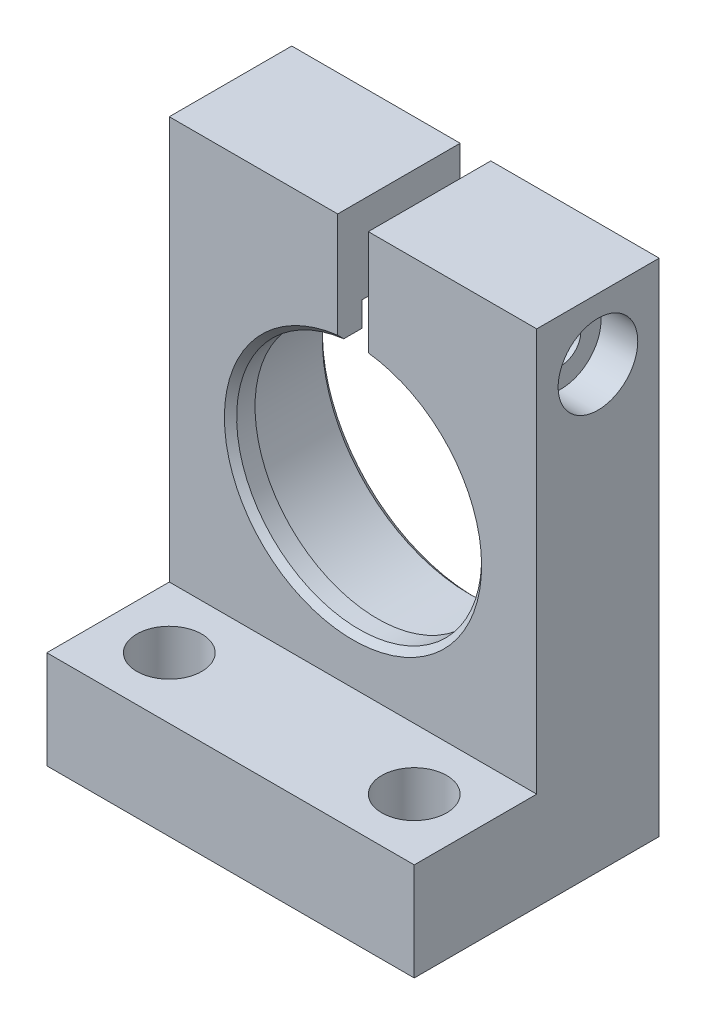
from build123d import *

# Parameters (mm, degrees)
SKETCH1_W                      = 30
SKETCH1_H                      = 40.9
SKETCH1_R                      = 12
BOSS_EXTRUDE1_DEPTH            = 10
BOSS_EXTRUDE2_START            = 2
SKETCH2_R                      = 12
SKETCH2_R_2                    = 10
BOSS_EXTRUDE2_DEPTH            = 2
SKETCH3_W                      = 2.5
SKETCH3_H                      = 9.078432584
CUT_EXTRUDE1_DEPTH             = 29.365648239
CBORE_FOR_M3_SHCS1_D           = 3.2
CBORE_FOR_M3_SHCS1_DEPTH       = 13.75
CBORE_FOR_M3_SHCS1_CBORE_D     = 6.5
CBORE_FOR_M3_SHCS1_CBORE_DEPTH = 3
TAP_DRILL_FOR_M3X0_5_TAP1_D    = 2.5
CHAMFER1_SIZE                  = 0.5
SKETCH8_W                      = 30
SKETCH8_H                      = 10
BOSS_EXTRUDE3_DEPTH            = 8
M5_CLEARANCE_HOLE1_D           = 5.3


with BuildPart() as part:
    # Sketch1 → Boss-Extrude1 (new body)
    with BuildSketch(Plane.XY):
        with Locations((0, -1.45)):
            Rectangle(SKETCH1_W, SKETCH1_H)
        Circle(SKETCH1_R, mode=Mode.SUBTRACT)
    extrude(amount=BOSS_EXTRUDE1_DEPTH)

    # Sketch2 → Boss-Extrude2 (add)
    with BuildSketch(Plane(origin=(0, 0, 10), x_dir=(-1, 0, 0), z_dir=(0, 0, -1)).offset(BOSS_EXTRUDE2_START)):
        Circle(SKETCH2_R)
        Circle(SKETCH2_R_2, mode=Mode.SUBTRACT)
    extrude(amount=-BOSS_EXTRUDE2_DEPTH)

    # Sketch3 → Cut-Extrude1 (cut, through all)
    with BuildSketch(Plane.XY.offset(10)):
        with Locations((0, 14.460783708)):
            Rectangle(SKETCH3_W, SKETCH3_H)
    extrude(amount=-CUT_EXTRUDE1_DEPTH, mode=Mode.SUBTRACT)

    # CBORE for M3 SHCS1
    with Locations(Plane(origin=(15, 0, 0), x_dir=(0, 0, -1), z_dir=(1, 0, 0))):
        with Locations((-5, 14)):
            CounterBoreHole(CBORE_FOR_M3_SHCS1_D / 2, CBORE_FOR_M3_SHCS1_CBORE_D / 2, CBORE_FOR_M3_SHCS1_CBORE_DEPTH, depth=CBORE_FOR_M3_SHCS1_DEPTH)

    # Tap Drill for M3x0.5 Tap1 (through all)
    with Locations(Plane.ZY.offset(15)):
        with Locations((5, 14)):
            Hole(TAP_DRILL_FOR_M3X0_5_TAP1_D / 2)

    # Chamfer1
    chamfer1_edges = [part.edges().sort_by_distance(p)[0] for p in [
        (0, -10, 10),
        (0, -12, 0),
    ]]
    chamfer(chamfer1_edges, length=CHAMFER1_SIZE)

    # Sketch8 → Boss-Extrude3 (add)
    with BuildSketch(Plane.XZ.offset(21.9)):
        with Locations((0, 15)):
            Rectangle(SKETCH8_W, SKETCH8_H)
    extrude(amount=-BOSS_EXTRUDE3_DEPTH)

    # M5 Clearance Hole1 (through all)
    with Locations(Plane(origin=(0, -13.9, 0), x_dir=(1, 0, 0), z_dir=(0, 1, 0))):
        with Locations((-10, -15), (10, -15)):
            Hole(M5_CLEARANCE_HOLE1_D / 2)


solid = part.part
